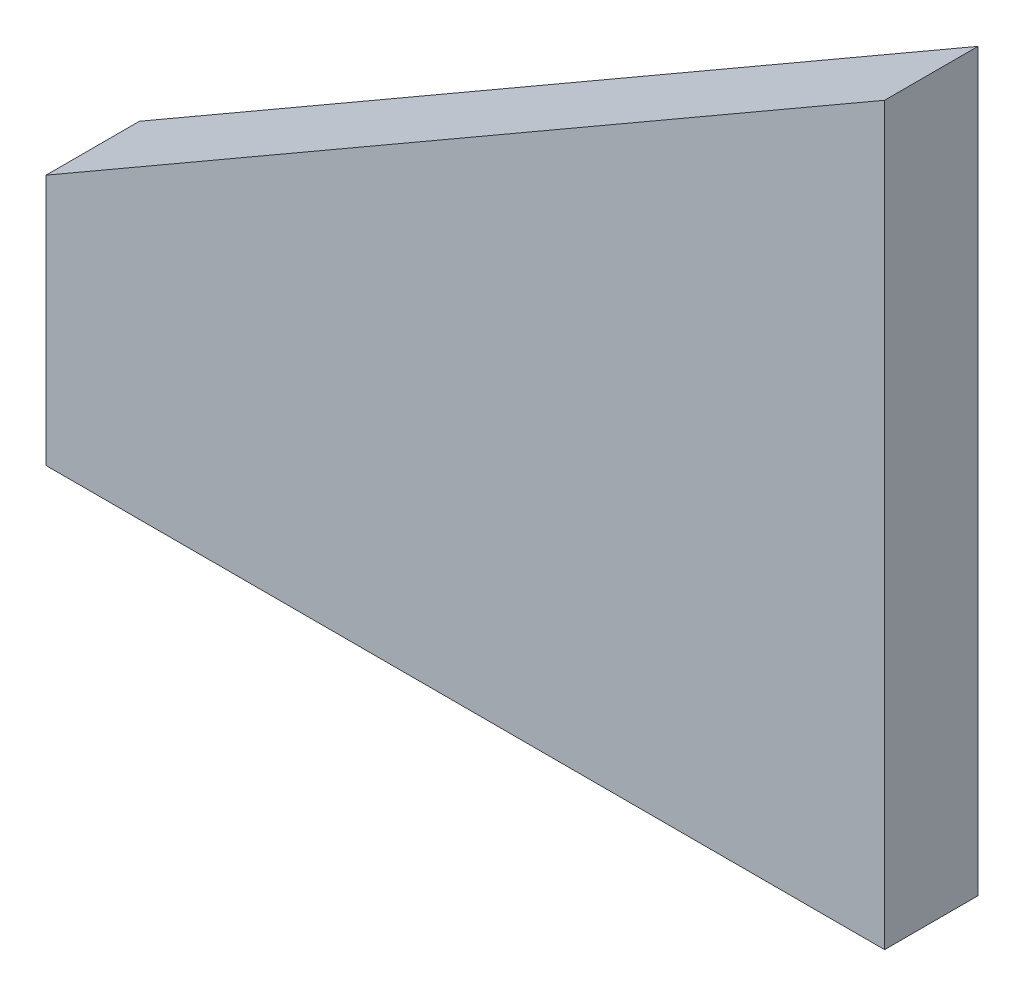
from build123d import *

# Parameters (mm, degrees)
BOSS_EXTRUDE1_DEPTH = 6.35


with BuildPart() as part:
    # Sketch1 → Boss-Extrude1 (new, symmetric)
    with BuildSketch(Plane.XY):
        Polygon((0, 0), (0, -100), (-114, -100), (-114, -65.817930688), align=None)
    extrude(amount=BOSS_EXTRUDE1_DEPTH, both=True)


solid = part.part
